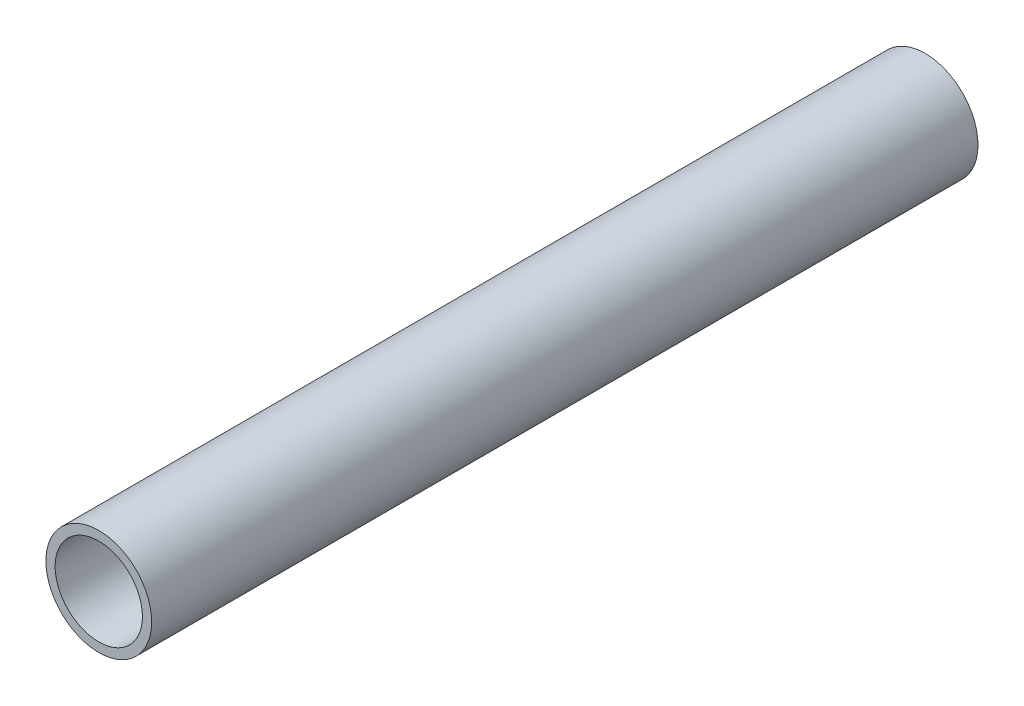
from build123d import *

# Parameters (mm, degrees)
SKETCH_1_R      = 10.9
SKETCH_1_R_2    = 9
EXTRUDE_1_DEPTH = 170.35


with BuildPart() as part:
    # Эскиз1 → Вытянуть1 (new body)
    with BuildSketch(Plane.XY):
        Circle(SKETCH_1_R)
        Circle(SKETCH_1_R_2, mode=Mode.SUBTRACT)
    extrude(amount=EXTRUDE_1_DEPTH)


solid = part.part
